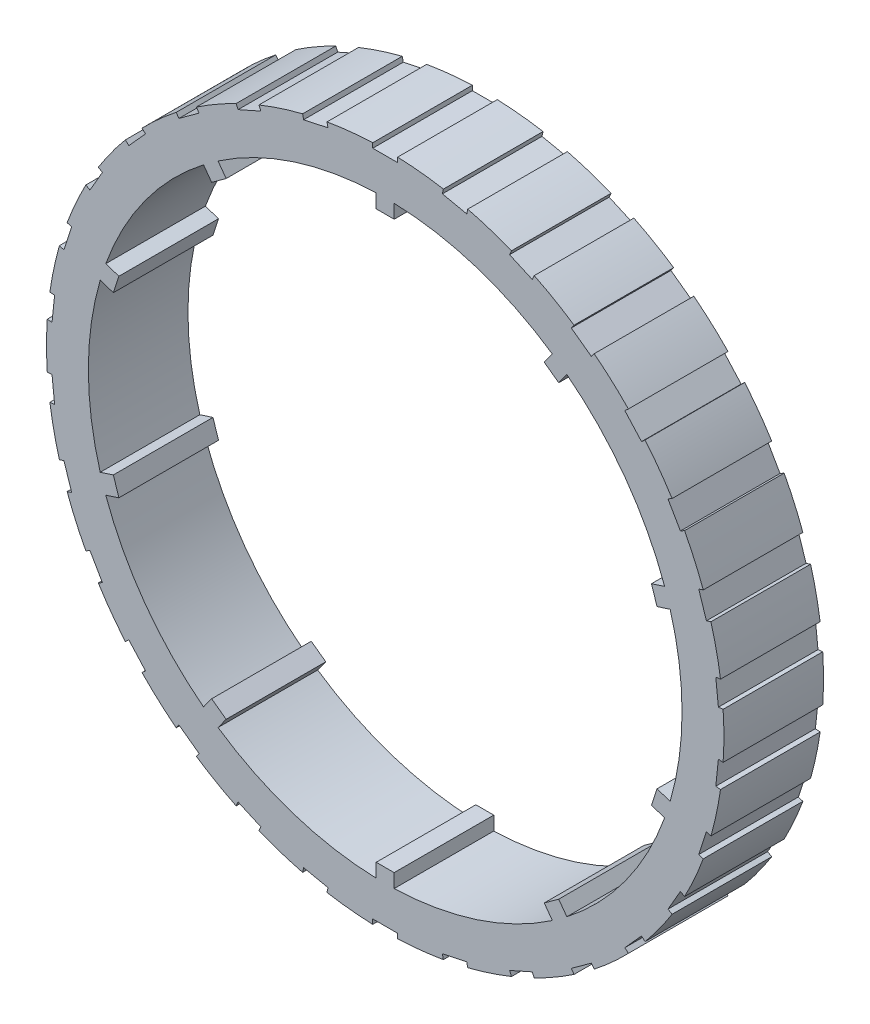
from build123d import *

# Parameters (mm, degrees)
SKETCH2_R           = 34
BOSS_EXTRUDE1_DEPTH = 10
SKETCH3_R           = 29.8
CUT_EXTRUDE1_DEPTH  = 50.112116631
SKETCH4_W           = 1.8
SKETCH4_H           = 2.8
BOSS_EXTRUDE2_DEPTH = 10
CIRPATTERN1_COUNT   = 10
SKETCH5_W           = 2.5
SKETCH5_H           = 1
CUT_EXTRUDE2_DEPTH  = 50.112116631
CIRPATTERN3_COUNT   = 30


with BuildPart() as part:
    # Sketch2 → Boss-Extrude1 (new body)
    with BuildSketch(Plane.XY):
        Circle(SKETCH2_R)
    extrude(amount=BOSS_EXTRUDE1_DEPTH)

    # Sketch3 → Cut-Extrude1 (cut, through all)
    with BuildSketch(Plane.XY):
        Circle(SKETCH3_R)
    extrude(amount=CUT_EXTRUDE1_DEPTH, mode=Mode.SUBTRACT)

    # Sketch4 → Boss-Extrude2 (add)
    with BuildSketch(Plane.XY):
        with Locations((0, 29.8)):
            Rectangle(SKETCH4_W, SKETCH4_H)
    boss_extrude2 = extrude(amount=BOSS_EXTRUDE2_DEPTH)

    # CirPattern1: Boss-Extrude2 ×10 about axis
    cirpattern1_axis = Axis((0, 0, 0), (0, 0, 1))
    for i in range(1, CIRPATTERN1_COUNT):
        add(boss_extrude2.rotate(cirpattern1_axis, i * 360 / CIRPATTERN1_COUNT))

    # Sketch5 → Cut-Extrude2 (cut, through all)
    with BuildSketch(Plane.XY):
        with Locations((0, 34)):
            Rectangle(SKETCH5_W, SKETCH5_H)
    cut_extrude2 = extrude(amount=CUT_EXTRUDE2_DEPTH, mode=Mode.SUBTRACT)

    # CirPattern3: Cut-Extrude2 ×30 about axis
    cirpattern3_axis = Axis((0, 0, 0), (0, 0, 1))
    for i in range(1, CIRPATTERN3_COUNT):
        add(cut_extrude2.rotate(cirpattern3_axis, i * 360 / CIRPATTERN3_COUNT), mode=Mode.SUBTRACT)


solid = part.part
